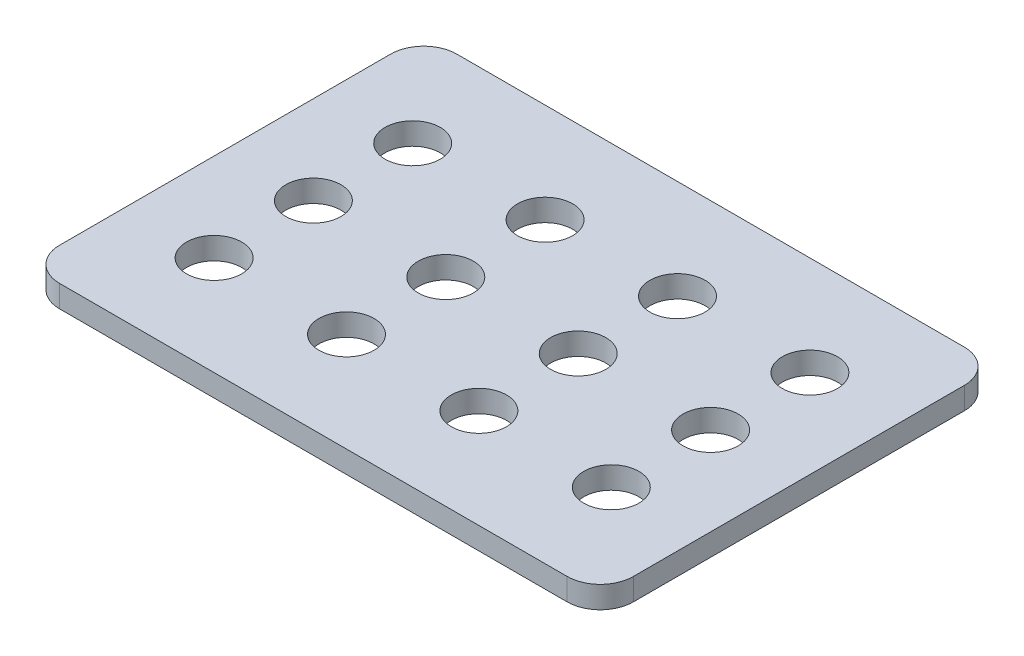
from build123d import *

# Parameters (mm, degrees)
SKETCH1_R           = 12.5
BOSS_EXTRUDE1_DEPTH = 10


with BuildPart() as part:
    # Sketch1 → Boss-Extrude1 (new body)
    with BuildSketch(Plane(origin=(0, 0, 0), x_dir=(1, 0, 0), z_dir=(0, 1, 0))):
        with BuildLine():
            Line((15, 0), (245, 0))
            ThreePointArc((245, 0), (255.606601718, 4.393398282), (260, 15))
            Line((260, 15), (260, 165))
            ThreePointArc((260, 165), (255.606601718, 175.606601718), (245, 180))
            Line((245, 180), (15, 180))
            ThreePointArc((15, 180), (4.393398282, 175.606601718), (0, 165))
            Line((0, 165), (0, 15))
            ThreePointArc((0, 15), (4.393398282, 4.393398282), (15, 0))
        make_face()
        with Locations(Location((40, 135, 0), (0, 0, 270))):
            Circle(SKETCH1_R, mode=Mode.SUBTRACT)
        with Locations(Location((100, 135, 0), (0, 0, 270))):
            Circle(SKETCH1_R, mode=Mode.SUBTRACT)
        with Locations(Location((160, 135, 0), (0, 0, 270))):
            Circle(SKETCH1_R, mode=Mode.SUBTRACT)
        with Locations(Location((220, 135, 0), (0, 0, 270))):
            Circle(SKETCH1_R, mode=Mode.SUBTRACT)
        with Locations(Location((100, 90, 0), (0, 0, 270))):
            Circle(SKETCH1_R, mode=Mode.SUBTRACT)
        with Locations(Location((160, 90, 0), (0, 0, 270))):
            Circle(SKETCH1_R, mode=Mode.SUBTRACT)
        with Locations(Location((220, 90, 0), (0, 0, 270))):
            Circle(SKETCH1_R, mode=Mode.SUBTRACT)
        with Locations(Location((100, 45, 0), (0, 0, 270))):
            Circle(SKETCH1_R, mode=Mode.SUBTRACT)
        with Locations(Location((160, 45, 0), (0, 0, 270))):
            Circle(SKETCH1_R, mode=Mode.SUBTRACT)
        with Locations(Location((220, 45, 0), (0, 0, 270))):
            Circle(SKETCH1_R, mode=Mode.SUBTRACT)
        with Locations(Location((40, 90, 0), (0, 0, 270))):
            Circle(SKETCH1_R, mode=Mode.SUBTRACT)
        with Locations(Location((40, 45, 0), (0, 0, 270))):
            Circle(SKETCH1_R, mode=Mode.SUBTRACT)
    extrude(amount=BOSS_EXTRUDE1_DEPTH)


solid = part.part
